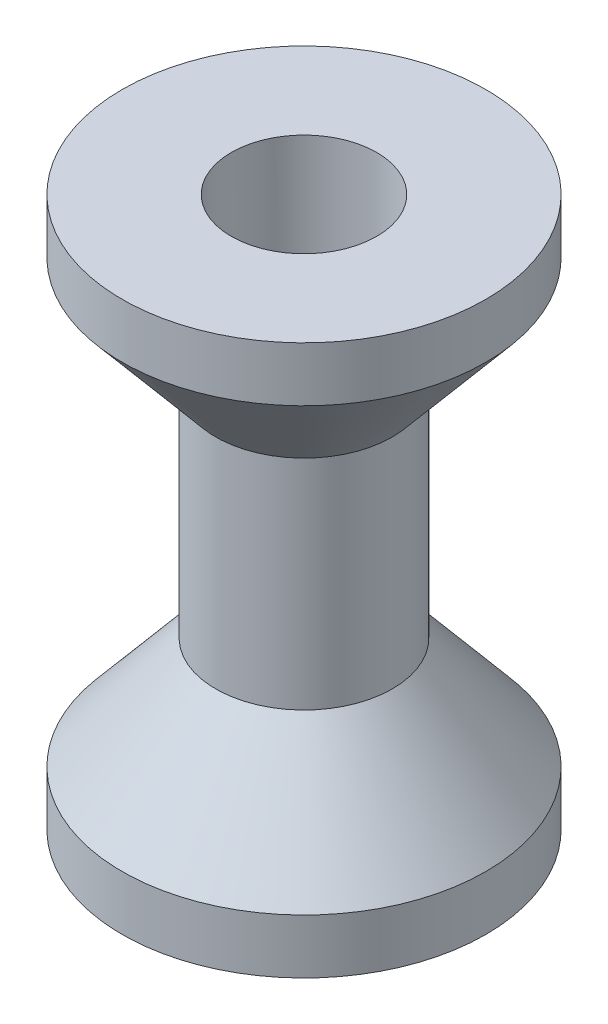
from build123d import *

# Parameters (mm, degrees)
CORTAR_EXTRUIR1_REACH = 37.16
CROQUIS2_R            = 4
CROQUIS3_R            = 5
CORTAR_EXTRUIR2_DEPTH = 5


with BuildPart() as part:
    # Croquis1 → Revolución1 (revolve)
    with BuildSketch(Plane.XY):
        Polygon((0, 6), (0, -6), (-5.142300877, -12.128355545), (-5.142300877, -15.128355545), (4.857699123, -15.128355545), (4.857699123, 15.128355545), (-5.142300877, 15.128355545), (-5.142300877, 12.128355545), align=None)
    revolve(axis=Axis((4.857699123, 15.128355545, 0), (0, -1, 0)))

    # Croquis2 → Cortar-Extruir1 (cut, up to next)
    with BuildSketch(Plane.XZ.offset(15.128355545), mode=Mode.PRIVATE) as cortar_extruir1_sk1:
        with Locations((4.857699123, 0)):
            Circle(CROQUIS2_R)
    cortar_extruir1_tool1 = extrude(cortar_extruir1_sk1.sketch, amount=-CORTAR_EXTRUIR1_REACH, mode=Mode.PRIVATE) & part.part
    add(cortar_extruir1_tool1.solids().sort_by_distance((4.857699, -15.128356, 0))[0], mode=Mode.SUBTRACT)

    # Croquis3 → Cortar-Extruir2 (cut)
    with BuildSketch(Plane.XZ.offset(15.128355545)):
        with Locations((4.857699123, 0)):
            Circle(CROQUIS3_R)
    extrude(amount=-CORTAR_EXTRUIR2_DEPTH, mode=Mode.SUBTRACT)


solid = part.part
